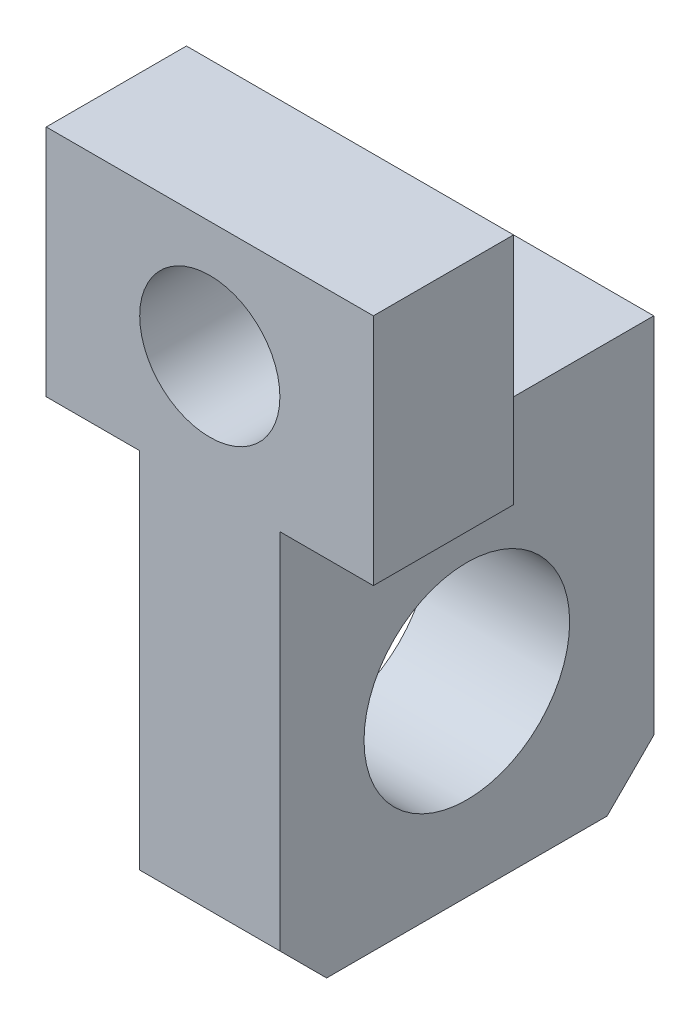
from build123d import *

# Parameters (mm, degrees)
SKETCH7_R          = 1.905
BASE_DEPTH         = 10.16
LEVER_HOLE_REACH   = 23.199
SKETCH8_R          = 2.794
CHAMFER2_SIZE      = 1.27
SKETCH9_W          = 8.89
SKETCH9_H          = 6.35
CUT_EXTRUDE4_DEPTH = 6.35


with BuildPart() as part:
    # Sketch7 → base (new body)
    with BuildSketch(Plane(origin=(0, 0, 0), x_dir=(0, 1, 0), z_dir=(0, 0, 1))):
        Polygon((11.138733525, 0), (11.138733525, -2.54), (17.488733525, -2.54), (17.488733525, 6.35), (11.138733525, 6.35), (11.138733525, 3.81), (0, 3.81), (0, 0), align=None)
        with Locations(Location((14.313733525, 1.905, 0), (0, 0, 270))):
            Circle(SKETCH7_R, mode=Mode.SUBTRACT)
    extrude(amount=BASE_DEPTH)

    # Sketch8 → lever_hole (cut, up to next)
    with BuildSketch(Plane.YZ, mode=Mode.PRIVATE) as lever_hole_sk1:
        with Locations(Location((5.08, 5.08, 0), (0, 0, 270))):
            Circle(SKETCH8_R)
    lever_hole_tool1 = extrude(lever_hole_sk1.sketch, amount=-LEVER_HOLE_REACH, mode=Mode.PRIVATE) & part.part
    add(lever_hole_tool1.solids().sort_by_distance((0, 5.08, 5.08))[0], mode=Mode.SUBTRACT)

    # Chamfer2
    chamfer2_edges = [part.edges().sort_by_distance(p)[0] for p in [
        (-1.905, 0, 0),
        (-1.905, 0, 10.16),
    ]]
    chamfer(chamfer2_edges, length=CHAMFER2_SIZE)

    # Sketch9 → Cut-Extrude4 (cut)
    with BuildSketch(Plane(origin=(0, 0, 0), x_dir=(1, 0, 0), z_dir=(0, 0, -1))):
        with Locations((-1.905, -14.313733525)):
            Rectangle(SKETCH9_W, SKETCH9_H)
    extrude(amount=-CUT_EXTRUDE4_DEPTH, mode=Mode.SUBTRACT)


solid = part.part
